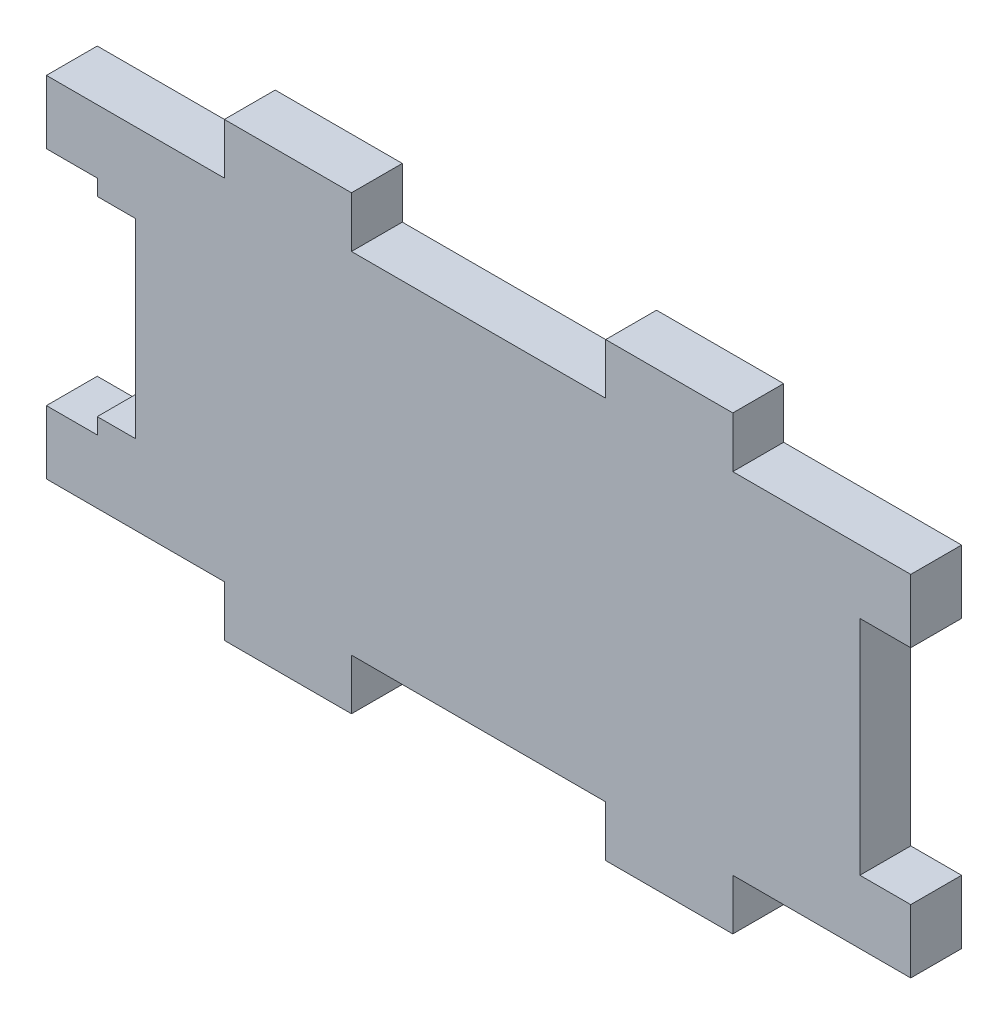
from build123d import *

# Parameters (mm, degrees)
SKETCH1_W           = 120
SKETCH1_H           = 55
BOSS_EXTRUDE1_DEPTH = 8
CUT_EXTRUDE1_REACH  = 68.485
SKETCH2_W           = 38.750815327
SKETCH2_H           = 30
SKETCH4_W           = 8
SKETCH4_H           = 10
BOSS_EXTRUDE3_DEPTH = 8
SKETCH6_W           = 20
SKETCH6_H           = 8
BOSS_EXTRUDE4_DEPTH = 8


with BuildPart() as part:
    # Sketch1 → Boss-Extrude1 (new body)
    with BuildSketch(Plane.XY):
        Rectangle(SKETCH1_W, SKETCH1_H)
    extrude(amount=BOSS_EXTRUDE1_DEPTH)

    # Sketch2 → Cut-Extrude1 (cut, up to next)
    with BuildSketch(Plane.XY.offset(8), mode=Mode.PRIVATE) as cut_extrude1_sk1:
        with Locations((-73.375407663, 0)):
            Rectangle(SKETCH2_W, SKETCH2_H)
    cut_extrude1_tool1 = extrude(cut_extrude1_sk1.sketch, amount=-CUT_EXTRUDE1_REACH, mode=Mode.PRIVATE) & part.part
    add(cut_extrude1_tool1.solids().sort_by_distance((-73.375408, 0, 8))[0], mode=Mode.SUBTRACT)

    # Sketch4 → Boss-Extrude3 (add)
    with BuildSketch(Plane(origin=(60, 0, 0), x_dir=(0, 0, -1), z_dir=(1, 0, 0))):
        with Locations((-4, 22.5)):
            Rectangle(SKETCH4_W, SKETCH4_H)
        with Locations((-4, -22.5)):
            Rectangle(SKETCH4_W, SKETCH4_H)
    boss_extrude3 = extrude(amount=BOSS_EXTRUDE3_DEPTH)

    # Sketch6 → Boss-Extrude4 (add)
    with BuildSketch(Plane.XZ.offset(27.5)):
        with Locations((-30, 4)):
            Rectangle(SKETCH6_W, SKETCH6_H)
        with Locations((30, 4)):
            Rectangle(SKETCH6_W, SKETCH6_H)
    boss_extrude4 = extrude(amount=BOSS_EXTRUDE4_DEPTH)

    # Mirror2: Boss-Extrude4 across plane
    add(boss_extrude4.mirror(Plane(origin=(0, 0, 0), x_dir=(0, 0, 1), z_dir=(0, -1, 0))))

    # Mirror3: Boss-Extrude3 across plane
    add(boss_extrude3.mirror(Plane.ZY))


solid = part.part
